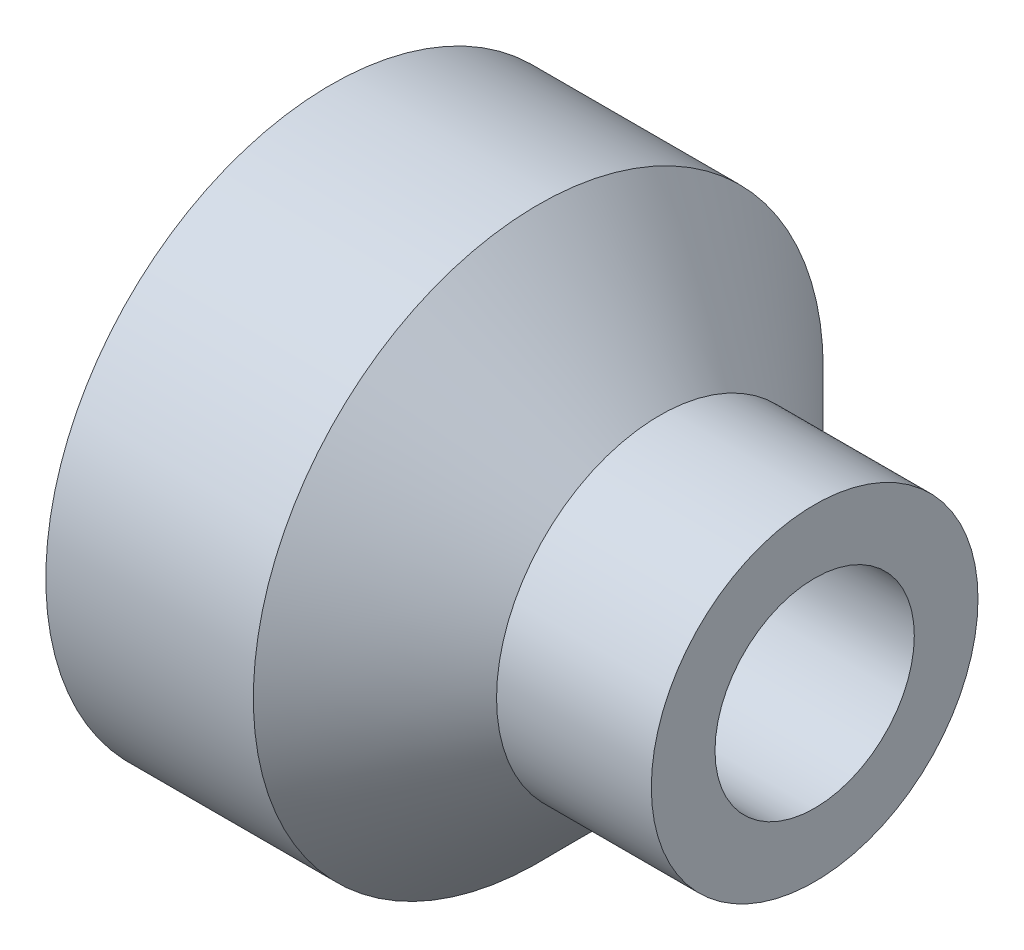
from build123d import *


with BuildPart() as part:
    # Sketch1 → Revolve1 (revolve)
    with BuildSketch(Plane.XY, mode=Mode.PRIVATE) as revolve1_sk:
        Polygon((-3.56242049, 4.546), (-0.25157951, 4.546), (1.68842049, 2.606), (4.15757951, 2.606), (4.15757951, 1.59), (1.26757951, 1.59), (-0.67242049, 3.53), (-3.56242049, 3.53), align=None)
    revolve(revolve1_sk.sketch.rotate(Axis((0, 0, 0), (-1, 0, 0)), 90), axis=Axis((0, 0, 0), (-1, 0, 0)))


solid = part.part
